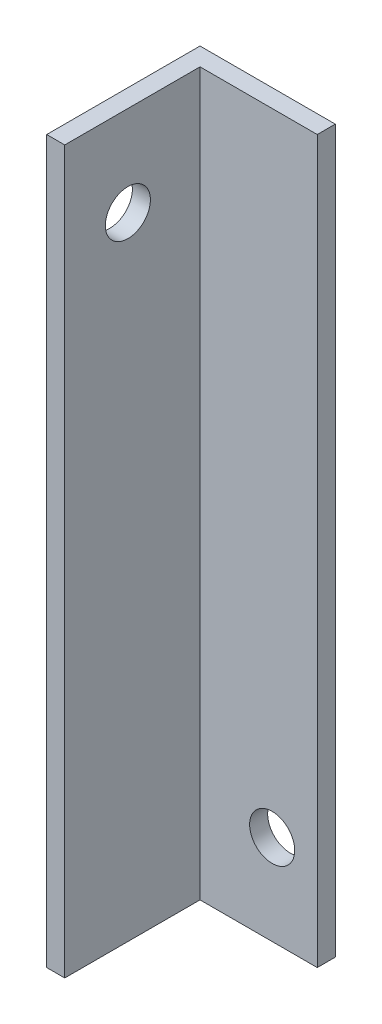
from build123d import *

# Parameters (mm, degrees)
ESQUISSE1_W             = 15
ESQUISSE1_H             = 80
BOSS_EXTRU_1_DEPTH      = 2
ESQUISSE2_W             = 2
ESQUISSE2_H             = 80
BOSS_EXTRU_2_DEPTH      = 15
ESQUISSE3_R             = 2.5
ENL_V_MAT_EXTRU_1_DEPTH = 20
ESQUISSE4_R             = 2.5
ENL_V_MAT_EXTRU_2_DEPTH = 20


with BuildPart() as part:
    # Esquisse1 → Boss.-Extru.1 (new body)
    with BuildSketch(Plane.XY):
        with Locations((7.5, -40)):
            Rectangle(ESQUISSE1_W, ESQUISSE1_H)
    extrude(amount=BOSS_EXTRU_1_DEPTH)

    # Esquisse2 → Boss.-Extru.2 (add)
    with BuildSketch(Plane.XY.offset(2)):
        with Locations((1, -40)):
            Rectangle(ESQUISSE2_W, ESQUISSE2_H)
    extrude(amount=BOSS_EXTRU_2_DEPTH)

    # Esquisse3 → Enlèv. mat.-Extru.1 (cut)
    with BuildSketch(Plane.XY.offset(2)):
        with Locations((10, -70)):
            Circle(ESQUISSE3_R)
    extrude(amount=-ENL_V_MAT_EXTRU_1_DEPTH, mode=Mode.SUBTRACT)

    # Esquisse4 → Enlèv. mat.-Extru.2 (cut)
    with BuildSketch(Plane.ZY):
        with Locations(Location((10, -10, 0), (0, 0, 270))):
            Circle(ESQUISSE4_R)
    extrude(amount=-ENL_V_MAT_EXTRU_2_DEPTH, mode=Mode.SUBTRACT)


solid = part.part
